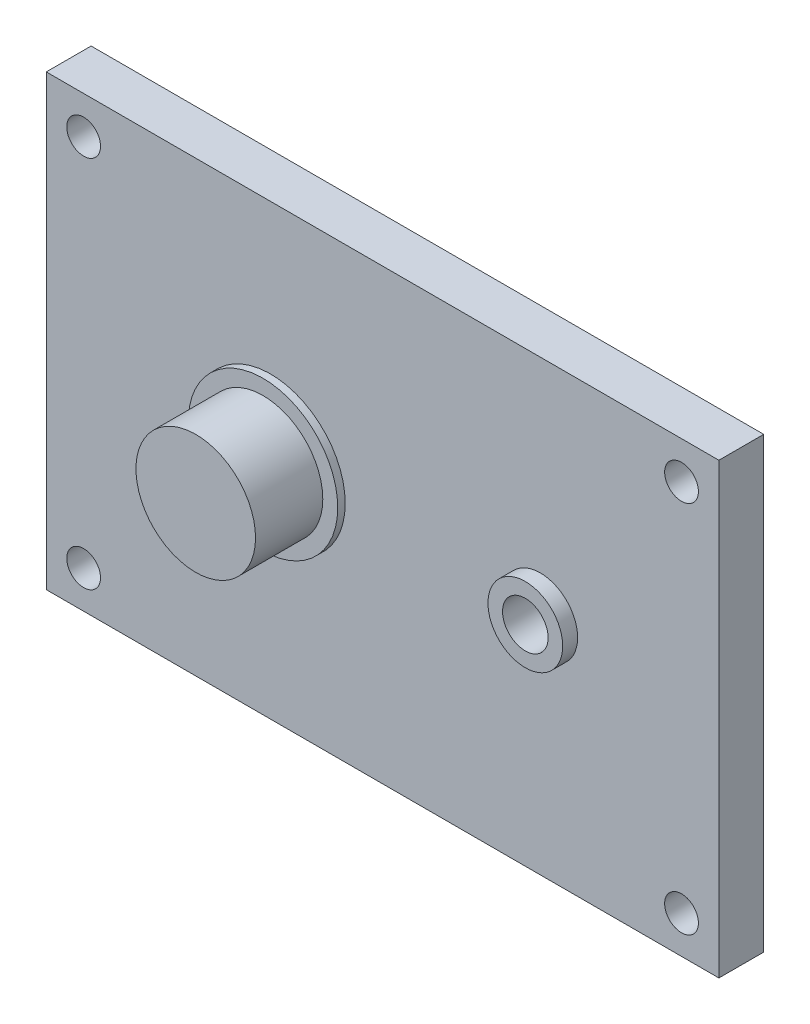
from build123d import *

# Parameters (mm, degrees)
SKETCH1_W             = 45
SKETCH1_H             = 30
SKETCH1_R             = 1.525
BOSS_EXTRUDE1_DEPTH   = 3
SKETCH2_R             = 4
BOSS_EXTRUDE2_DEPTH   = 5
SKETCH3_R             = 5
BOSS_EXTRUDE3_DEPTH   = 0.5
F_2_CLEARANCE_HOLE1_D = 2.2606
SKETCH6_R             = 2.5
SKETCH6_R_2           = 1.525
BOSS_EXTRUDE4_DEPTH   = 1


with BuildPart() as part:
    # Sketch1 → Boss-Extrude1 (new body)
    with BuildSketch(Plane.XY):
        with Locations((7.5, 0)):
            Rectangle(SKETCH1_W, SKETCH1_H)
        with Locations((18.050000068, 0)):
            Circle(SKETCH1_R, mode=Mode.SUBTRACT)
    extrude(amount=BOSS_EXTRUDE1_DEPTH)

    # Sketch2 → Boss-Extrude2 (add)
    with BuildSketch(Plane.XY.offset(3)):
        Circle(SKETCH2_R)
    extrude(amount=BOSS_EXTRUDE2_DEPTH)

    # Sketch3 → Boss-Extrude3 (add)
    with BuildSketch(Plane.XY.offset(3)):
        Circle(SKETCH3_R)
    extrude(amount=BOSS_EXTRUDE3_DEPTH)

    # #2 Clearance Hole1 (through all)
    with Locations(Plane.XY.offset(3)):
        with Locations((-12.5, 12.5), (-12.5, -12.5), (27.5, -12.5), (27.5, 12.5)):
            Hole(F_2_CLEARANCE_HOLE1_D / 2)

    # Sketch6 → Boss-Extrude4 (add)
    with BuildSketch(Plane.XY.offset(3)):
        with Locations((18.050000068, 0)):
            Circle(SKETCH6_R)
        with Locations((18.050000068, 0)):
            Circle(SKETCH6_R_2, mode=Mode.SUBTRACT)
    extrude(amount=BOSS_EXTRUDE4_DEPTH)


solid = part.part
